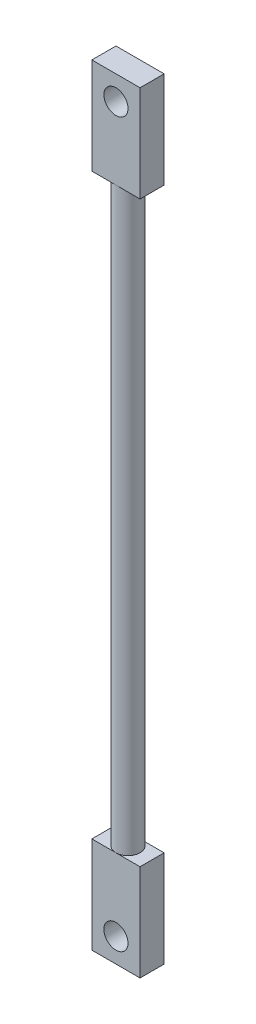
from build123d import *

# Parameters (mm, degrees)
SKETCH1_R           = 1.5875
BOSS_EXTRUDE1_DEPTH = 38.1
SKETCH2_W           = 6.35
SKETCH2_H           = 3.175
BOSS_EXTRUDE2_DEPTH = 12.7
SKETCH3_R           = 1.5875
CUT_EXTRUDE1_DEPTH  = 51.998051433


with BuildPart() as part:
    # Sketch1 → Boss-Extrude1 (new body)
    with BuildSketch(Plane(origin=(0, 0, 0), x_dir=(1, 0, 0), z_dir=(0, 1, 0))):
        with Locations(Location((0, 0, 0), (0, 0, 90))):
            Circle(SKETCH1_R)
    boss_extrude1 = extrude(amount=BOSS_EXTRUDE1_DEPTH)

    # Sketch2 → Boss-Extrude2 (add)
    with BuildSketch(Plane(origin=(0, 38.1, 0), x_dir=(1, 0, 0), z_dir=(0, 1, 0))):
        Rectangle(SKETCH2_W, SKETCH2_H)
    boss_extrude2 = extrude(amount=BOSS_EXTRUDE2_DEPTH)

    # Sketch3 → Cut-Extrude1 (cut, through all)
    with BuildSketch(Plane(origin=(0, 0, -1.5875), x_dir=(-1, 0, 0), z_dir=(0, 0, -1))):
        with Locations((0, 47.625)):
            Circle(SKETCH3_R)
    cut_extrude1 = extrude(amount=-CUT_EXTRUDE1_DEPTH, mode=Mode.SUBTRACT)

    # Mirror1: Boss-Extrude1, Boss-Extrude2, Cut-Extrude1 across plane
    add(boss_extrude1.mirror(Plane.ZX))
    add(boss_extrude2.mirror(Plane.ZX))
    add(cut_extrude1.mirror(Plane.ZX), mode=Mode.SUBTRACT)


solid = part.part
